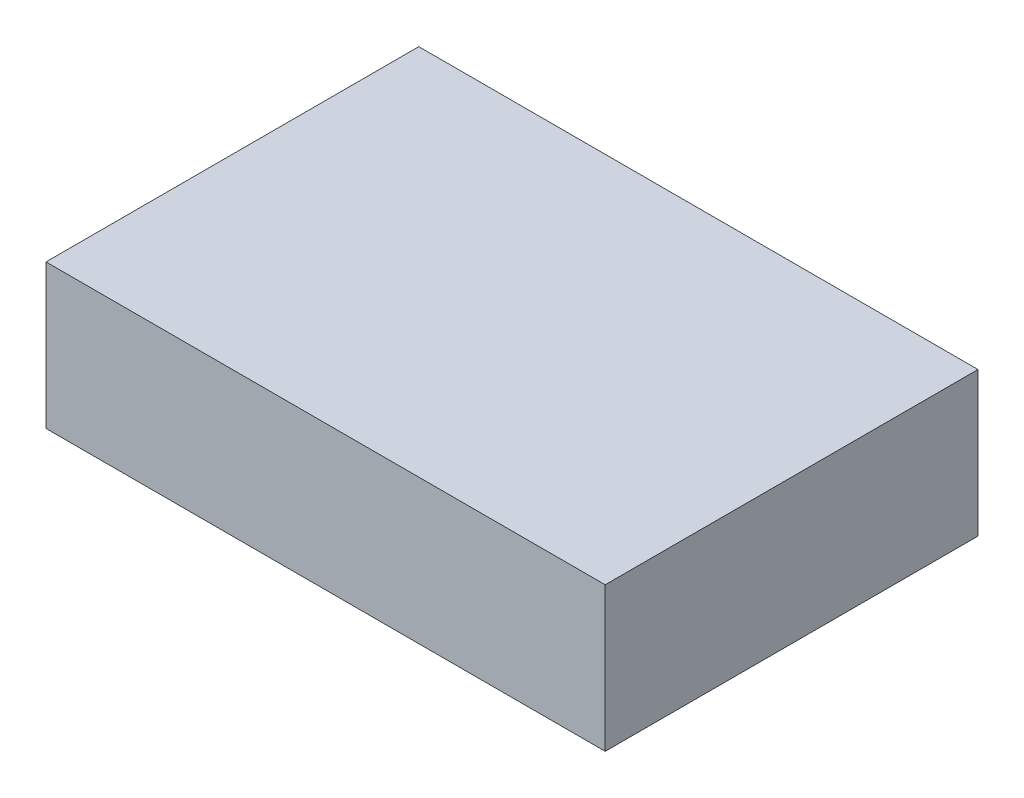
from build123d import *

# Parameters (mm, degrees)
SKETCH1_W           = 76.2
SKETCH1_H           = 50.8
BOSS_EXTRUDE1_DEPTH = 19.6596
SKETCH2_R           = 2.54
BOSS_EXTRUDE2_DEPTH = 6.35


with BuildPart() as part:
    # Sketch1 → Boss-Extrude1 (new body)
    with BuildSketch(Plane(origin=(0, 0, 0), x_dir=(1, 0, 0), z_dir=(0, 1, 0))):
        Rectangle(SKETCH1_W, SKETCH1_H)
    extrude(amount=BOSS_EXTRUDE1_DEPTH)

    # Sketch2 → Boss-Extrude2 (add)
    with BuildSketch(Plane(origin=(0, 0, 0), x_dir=(-1, 0, 0), z_dir=(0, -1, 0))):
        with Locations(Location((0, 0, 0), (0, 0, 270))):
            Circle(SKETCH2_R)
    extrude(amount=BOSS_EXTRUDE2_DEPTH)


solid = part.part
